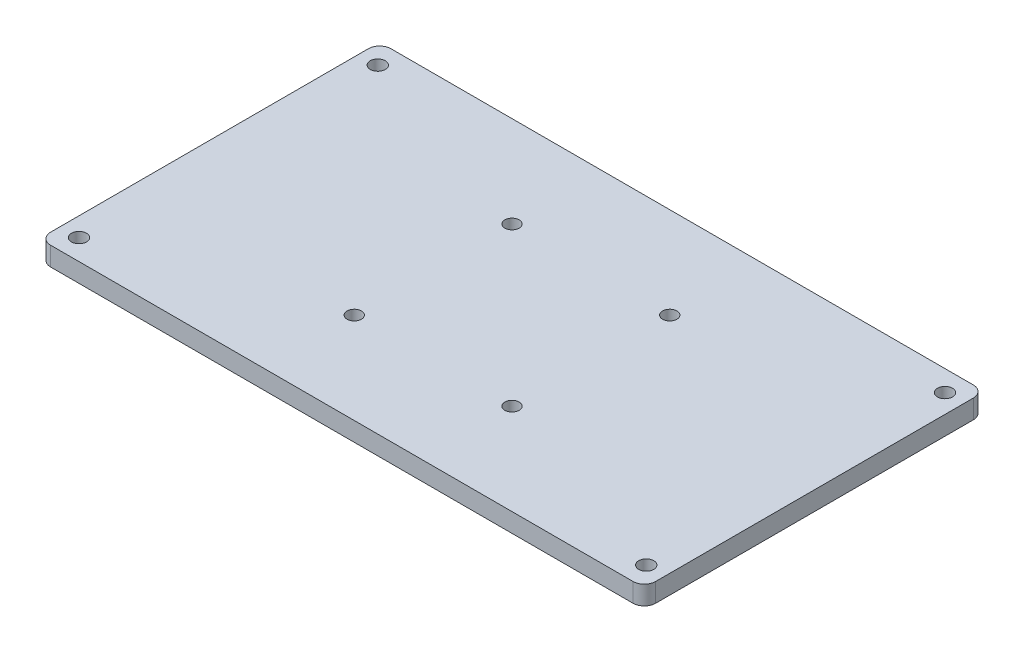
from build123d import *

# Parameters (mm, degrees)
SKETCH_1_W      = 160
SKETCH_1_H      = 90
SKETCH_1_R      = 1.9
SKETCH_1_R_2    = 2
EXTRUDE_1_DEPTH = 5
FILLET_5_R      = 3


with BuildPart() as part:
    # Эскиз1 → Бобышка-Вытянуть1 (new body)
    with BuildSketch(Plane(origin=(0, 0, 0), x_dir=(1, 0, 0), z_dir=(0, 1, 0))):
        Rectangle(SKETCH_1_W, SKETCH_1_H)
        with Locations(Location((20.859650045, 20.859650045, 0), (0, 0, 270))):
            Circle(SKETCH_1_R, mode=Mode.SUBTRACT)
        with Locations(Location((20.859650045, -20.859650045, 0), (0, 0, 270))):
            Circle(SKETCH_1_R, mode=Mode.SUBTRACT)
        with Locations(Location((-20.859650045, -20.859650045, 0), (0, 0, 270))):
            Circle(SKETCH_1_R, mode=Mode.SUBTRACT)
        with Locations(Location((-20.859650045, 20.859650045, 0), (0, 0, 270))):
            Circle(SKETCH_1_R, mode=Mode.SUBTRACT)
        with Locations(Location((-75, 39.5, 0), (0, 0, 270))):
            Circle(SKETCH_1_R_2, mode=Mode.SUBTRACT)
        with Locations(Location((75, 39.5, 0), (0, 0, 270))):
            Circle(SKETCH_1_R_2, mode=Mode.SUBTRACT)
        with Locations(Location((75, -39.5, 0), (0, 0, 270))):
            Circle(SKETCH_1_R_2, mode=Mode.SUBTRACT)
        with Locations(Location((-75, -39.5, 0), (0, 0, 270))):
            Circle(SKETCH_1_R_2, mode=Mode.SUBTRACT)
    extrude(amount=EXTRUDE_1_DEPTH)

    # Скругление5
    fillet_5_edges = [part.edges().sort_by_distance(p)[0] for p in [
        (80, 2.5, 45),
        (-80, 2.5, 45),
        (-80, 2.5, -45),
        (80, 2.5, -45),
    ]]
    fillet(fillet_5_edges, radius=FILLET_5_R)


solid = part.part
